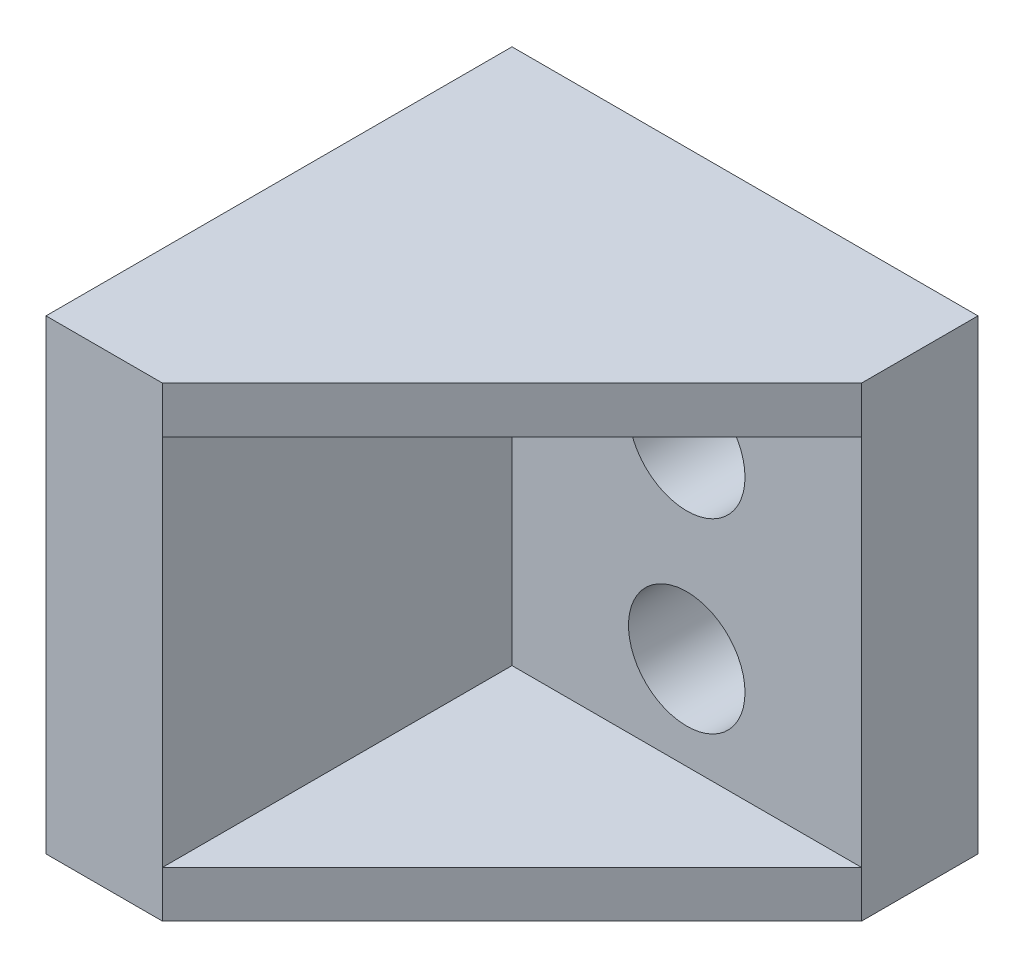
from build123d import *

# Parameters (mm, degrees)
BOSS_EXTRUDE1_DEPTH = 10
SKETCH3_R           = 1.25
CUT_EXTRUDE1_DEPTH  = 10
BOSS_EXTRUDE2_DEPTH = 1


with BuildPart() as part:
    # Sketch2 → Boss-Extrude1 (new body)
    with BuildSketch(Plane(origin=(0, 0, 0), x_dir=(1, 0, 0), z_dir=(0, 1, 0))):
        Polygon((0, 2.5), (-5, 2.5), (-5, -2.5), (-5, -7.5), (-2.5, -7.5), (-2.5, 0), (5, 0), (5, 2.5), align=None)
    extrude(amount=BOSS_EXTRUDE1_DEPTH)

    # Sketch3 → Cut-Extrude1 (cut)
    with BuildSketch(Plane.XY):
        with Locations((1.25, 7)):
            Circle(SKETCH3_R)
    cut_extrude1 = extrude(amount=-CUT_EXTRUDE1_DEPTH, mode=Mode.SUBTRACT)

    # Mirror1: Cut-Extrude1 across plane
    add(cut_extrude1.mirror(Plane(origin=(0, 5, 0), x_dir=(0, 0, 1), z_dir=(0, -1, 0))), mode=Mode.SUBTRACT)

    # Sketch4 → Boss-Extrude2 (add)
    with BuildSketch(Plane(origin=(0, 10, 0), x_dir=(1, 0, 0), z_dir=(0, 1, 0))):
        Polygon((-2.5, -7.5), (5, 0), (-2.5, 0), align=None)
    boss_extrude2 = extrude(amount=-BOSS_EXTRUDE2_DEPTH)

    # Mirror2: Boss-Extrude2 across plane
    add(boss_extrude2.mirror(Plane(origin=(0, 5, 0), x_dir=(0, 0, 1), z_dir=(0, -1, 0))))


solid = part.part
